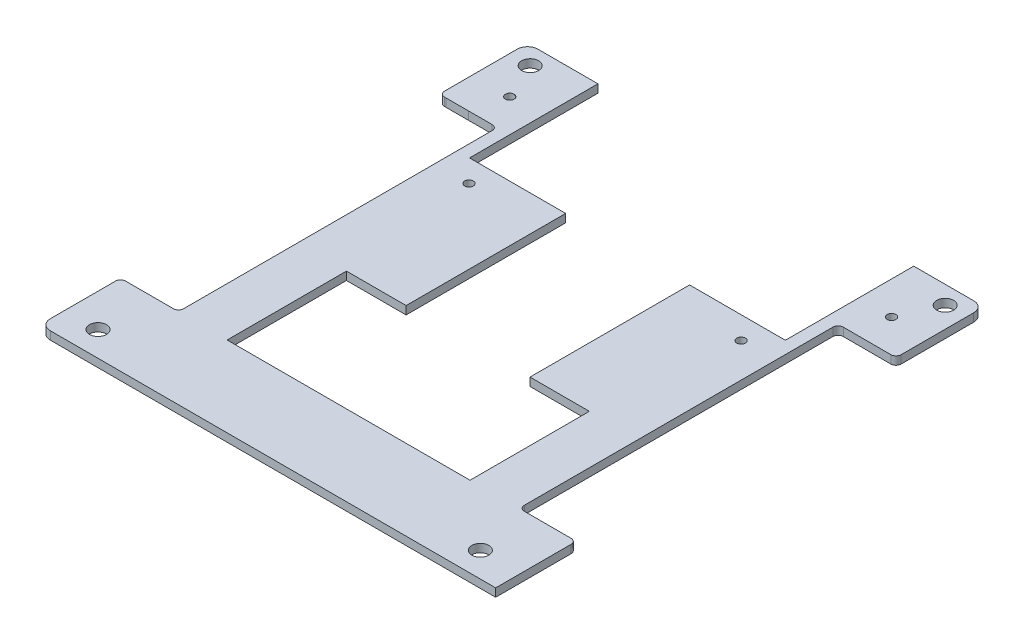
from build123d import *

# Parameters (mm, degrees)
SKETCH1_2_R         = 1.6383
SKETCH1_2_R_2       = 0.8382
BOSS_EXTRUDE2_DEPTH = 1.575


with BuildPart() as part:
    # Sketch1<2> → Boss-Extrude2 (new body)
    with BuildSketch(Plane(origin=(0, 0, 0), x_dir=(1, 0, 0), z_dir=(0, 1, 0))):
        with BuildLine():
            Line((-38.39500299, 29.999999735), (-42.73000299, 29.999999735))
            Line((-42.73000299, 29.999999735), (-43.011025994, 30.003097626))
            ThreePointArc((-43.011025994, 30.003097626), (-43.710996344, 30.299838092), (-44.000003042, 31.003036872))
            Line((-44.000003042, 31.003036872), (-44.000003042, 31.269999735))
            Line((-44.000003042, 31.269999735), (-44.000005679, 44.999999735))
            ThreePointArc((-44.000005679, 44.999999735), (-43.414218633, 46.414215608), (-42.000002924, 47.000003051))
            Line((-42.000002924, 47.000003051), (-30.435003, 47.000003051))
            Line((-30.435003, 47.000003051), (-30.435003, 22.255357341))
            Line((-30.435003, 22.255357341), (-11.909003, 22.255357341))
            Line((-11.909003, 22.255357341), (-11.909003, -8.5))
            Line((-11.909003, -8.5), (-23.409003, -8.5))
            Line((-23.409003, -8.5), (-23.409003, -31.499996949))
            Line((-23.409003, -31.499996949), (23.408997, -31.499996949))
            Line((23.408997, -31.499996949), (23.408997, -8.499997555))
            Line((23.408997, -8.499997555), (11.97084713, -8.499997555))
            Line((11.97084713, -8.499997555), (11.97084713, 22.255357341))
            Line((11.97084713, 22.255357341), (30.434997, 22.255357341))
            Line((30.434997, 22.255357341), (30.434997, 47.000003051))
            Line((30.434997, 47.000003051), (42.000008541, 47.000003051))
            ThreePointArc((42.000008541, 47.000003051), (43.414213215, 46.414220704), (43.999996956, 45.000016607))
            Line((43.999996956, 45.000016607), (43.999996956, 32.000003378))
            Line((43.999996956, 32.000003378), (43.999996956, 31.015615364))
            ThreePointArc((43.999996956, 31.015615364), (43.706534093, 30.307939396), (42.998386406, 30.015616661))
            Line((42.998386406, 30.015616661), (33.825607551, 30.030389905))
            ThreePointArc((33.825607551, 30.030389905), (33.117459864, 29.738067169), (32.823997, 29.030391202))
            Line((32.823997, 29.030391202), (32.823997, -30.453996949))
            ThreePointArc((32.823997, -30.453996949), (33.116890219, -31.16110373), (33.823997, -31.453996949))
            Line((33.823997, -31.453996949), (36.099999555, -31.453996949))
            Line((36.099999555, -31.453996949), (42.849728118, -31.453996949))
            ThreePointArc((42.849728118, -31.453996949), (43.556834899, -31.746890168), (43.849728118, -32.453996949))
            Line((43.849728118, -32.453996949), (43.849728118, -36.999996949))
            Line((43.849728118, -36.999996949), (43.849728118, -46.999996949))
            Line((43.849728118, -46.999996949), (-42.000000178, -46.999996949))
            ThreePointArc((-42.000000178, -46.999996949), (-43.414212804, -46.414211581), (-44.000000499, -44.999999921))
            Line((-44.000000499, -44.999999921), (-44.000000178, -38.976999921))
            Line((-44.000000178, -38.976999921), (-44.000000178, -32.453999802))
            ThreePointArc((-44.000000178, -32.453999802), (-43.70710696, -31.746893021), (-43.000000178, -31.453999802))
            Line((-43.000000178, -31.453999802), (-36.100000549, -31.453999802))
            Line((-36.100000549, -31.453999802), (-33.824003042, -31.453999802))
            ThreePointArc((-33.824003042, -31.453999802), (-33.116896261, -31.161106583), (-32.824003042, -30.453999802))
            Line((-32.824003042, -30.453999802), (-32.824003042, 29.011483943))
            ThreePointArc((-32.824003042, 29.011483943), (-33.117785331, 29.719478678), (-33.826516131, 30.011480785))
            Line((-33.826516131, 30.011480785), (-38.39500299, 29.999999735))
        make_face()
        with Locations((40, 43.5)):
            Circle(SKETCH1_2_R, mode=Mode.SUBTRACT)
        with Locations((-40, 43.5)):
            Circle(SKETCH1_2_R, mode=Mode.SUBTRACT)
        with Locations((-37.6, -42.2)):
            Circle(SKETCH1_2_R, mode=Mode.SUBTRACT)
        with Locations((36.1, -42.2)):
            Circle(SKETCH1_2_R, mode=Mode.SUBTRACT)
        with Locations((-36.785003, 36.350003051)):
            Circle(SKETCH1_2_R_2, mode=Mode.SUBTRACT)
        with Locations((-26.220003, 17.93193176)):
            Circle(SKETCH1_2_R_2, mode=Mode.SUBTRACT)
        with Locations((26.219997, 17.93193176)):
            Circle(SKETCH1_2_R_2, mode=Mode.SUBTRACT)
        with Locations((36.784997, 36.368003051)):
            Circle(SKETCH1_2_R_2, mode=Mode.SUBTRACT)
    extrude(amount=BOSS_EXTRUDE2_DEPTH)


solid = part.part
